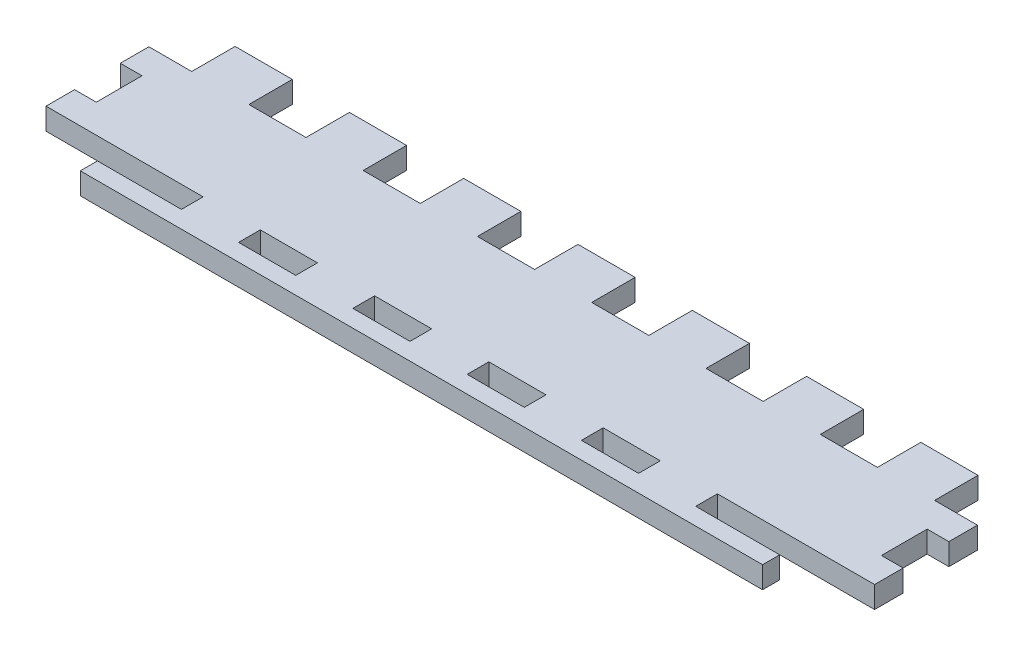
from build123d import *

# Parameters (mm, degrees)
SKETCH1_W           = 145
SKETCH1_H           = 18
BOSS_EXTRUDE1_DEPTH = 3.8
SKETCH2_W           = 10
SKETCH2_H           = 3.8
SKETCH2_H_2         = 7.6
BOSS_EXTRUDE2_DEPTH = 3.8
LPATTERN1_COUNT     = 4
LPATTERN1_PITCH     = 20
LPATTERN1_COL_COUNT = 4
LPATTERN1_COL_PITCH = 20
SKETCH3_W           = 145
SKETCH3_H           = 3
BOSS_EXTRUDE3_DEPTH = 3.8
SKETCH4_W           = 10
SKETCH4_H           = 3.8
CUT_EXTRUDE1_DEPTH  = 148.154612568
SKETCH5_W           = 12.8
SKETCH5_H           = 3
CUT_EXTRUDE2_DEPTH  = 148.154612568
SKETCH6_W           = 3.8
SKETCH6_H           = 8
CUT_EXTRUDE3_DEPTH  = 148.154612568


with BuildPart() as part:
    # Sketch1 → Boss-Extrude1 (new body)
    with BuildSketch(Plane(origin=(0, 0, 0), x_dir=(1, 0, 0), z_dir=(0, 1, 0))):
        with Locations((72.5, -9)):
            Rectangle(SKETCH1_W, SKETCH1_H)
    extrude(amount=BOSS_EXTRUDE1_DEPTH)

    # Sketch2 → Boss-Extrude2 (add, through all)
    with BuildSketch(Plane.XZ):
        with Locations((72.5, 19.9)):
            Rectangle(SKETCH2_W, SKETCH2_H)
        with Locations((72.5, -3.8)):
            Rectangle(SKETCH2_W, SKETCH2_H_2)
    boss_extrude2 = extrude(amount=-BOSS_EXTRUDE2_DEPTH)

    # LPattern1: Boss-Extrude2 ×4
    with Locations(*[(i * LPATTERN1_PITCH, 0, 0) for i in range(1, LPATTERN1_COUNT)]):
        add(boss_extrude2)

    # LPattern1 col: Boss-Extrude2 ×4
    with Locations(*[(-i * LPATTERN1_COL_PITCH, 0, 0) for i in range(1, LPATTERN1_COL_COUNT)]):
        add(boss_extrude2)

    # Sketch3 → Boss-Extrude3 (add, through all)
    with BuildSketch(Plane(origin=(0, 3.8, 0), x_dir=(1, 0, 0), z_dir=(0, 1, 0))):
        with Locations((72.5, -23.3)):
            Rectangle(SKETCH3_W, SKETCH3_H)
    extrude(amount=-BOSS_EXTRUDE3_DEPTH)

    # Sketch4 → Cut-Extrude1 (cut, through all)
    with BuildSketch(Plane(origin=(0, 3.8, 0), x_dir=(1, 0, 0), z_dir=(0, 1, 0))):
        with Locations((12.5, -19.9)):
            Rectangle(SKETCH4_W, SKETCH4_H)
        with Locations((132.5, -19.9)):
            Rectangle(SKETCH4_W, SKETCH4_H)
    extrude(amount=-CUT_EXTRUDE1_DEPTH, mode=Mode.SUBTRACT)

    # Sketch5 → Cut-Extrude2 (cut, through all)
    with BuildSketch(Plane(origin=(0, 3.8, 0), x_dir=(1, 0, 0), z_dir=(0, 1, 0))):
        with Locations((6.4, -23.3)):
            Rectangle(SKETCH5_W, SKETCH5_H)
        with Locations((138.6, -23.3)):
            Rectangle(SKETCH5_W, SKETCH5_H)
    extrude(amount=-CUT_EXTRUDE2_DEPTH, mode=Mode.SUBTRACT)

    # Sketch6 → Cut-Extrude3 (cut, through all)
    with BuildSketch(Plane.XZ):
        with Locations((1.9, 9)):
            Rectangle(SKETCH6_W, SKETCH6_H)
        with Locations((143.1, 9)):
            Rectangle(SKETCH6_W, SKETCH6_H)
    extrude(amount=-CUT_EXTRUDE3_DEPTH, mode=Mode.SUBTRACT)


solid = part.part
